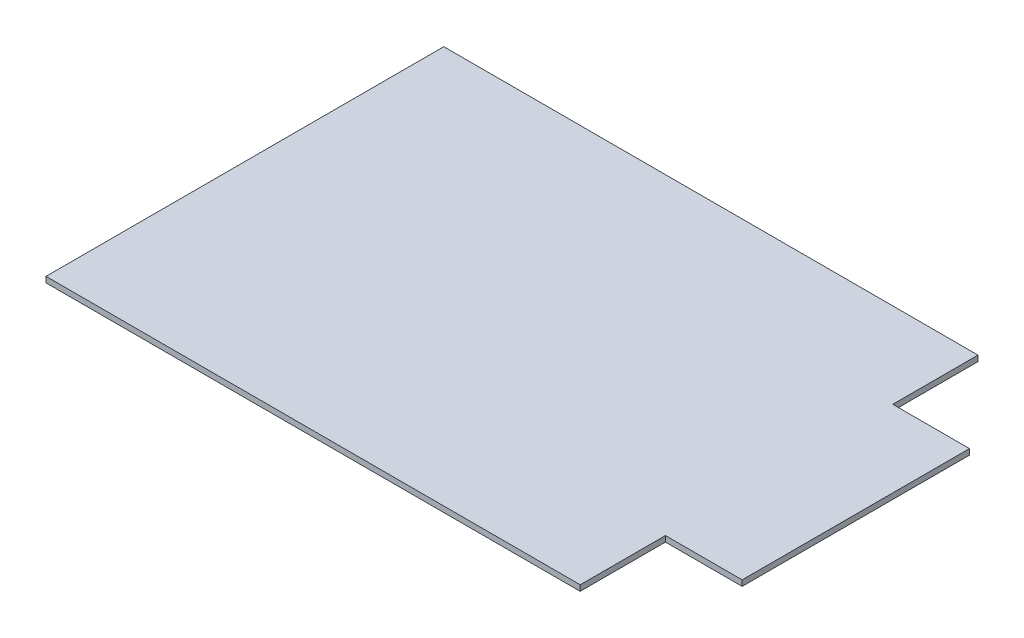
from build123d import *

# Parameters (mm, degrees)
BOSS_EXTRUDE1_DEPTH = 2


with BuildPart() as part:
    # Sketch1 → Boss-Extrude1 (new body)
    with BuildSketch(Plane(origin=(0, 0, 0), x_dir=(1, 0, 0), z_dir=(0, 1, 0))):
        Polygon((-55.20466454, 60.475696308), (-55.20466454, -79.524303692), (132.79533546, -79.524303692), (132.79533546, -49.524303692), (159.79533546, -49.524303692), (159.79533546, 30.475696308), (132.79533546, 30.475696308), (132.79533546, 60.475696308), align=None)
    extrude(amount=BOSS_EXTRUDE1_DEPTH)


solid = part.part
